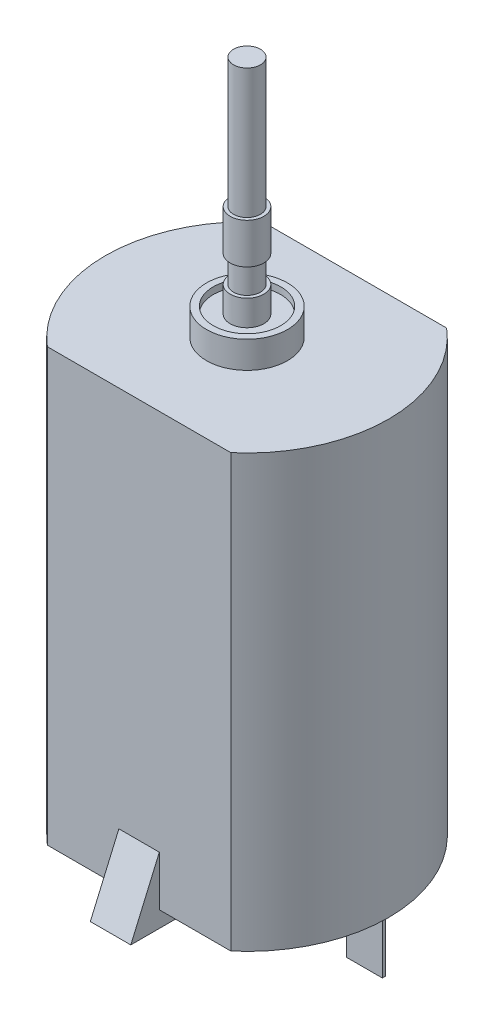
from build123d import *

# Parameters (mm, degrees)
SKETCH_1_W          = 21
SKETCH_1_H          = 16
EXTRUDE_1_DEPTH     = 32
SKETCH_2_R          = 3
EXTRUDE_2_DEPTH     = 2
CUT_EXTRUDE_1_DEPTH = 37.47259245
SKETCH_4_W          = 2.646859644
SKETCH_4_H          = 0.228740956
EXTRUDE_3_DEPTH     = 4
EXTRUDE_START       = 2
SKETCH_5_R          = 3
EXTRUDE_4_DEPTH     = 2
SKETCH_6_R          = 2.5
CUT_EXTRUDE_2_DEPTH = 0.5
SKETCH_7_R          = 1
EXTRUDE_5_DEPTH     = 16.5
SKETCH_8_R          = 1.25
SKETCH_8_R_2        = 1
EXTRUDE_6_DEPTH     = 1.9
SKETCH_9_R          = 1.25
SKETCH_9_R_2        = 1
EXTRUDE_7_DEPTH     = 3
EXTRUDE_8_DEPTH     = 1.5
EXTRUDE_8_2_DEPTH   = 1.5


with BuildPart() as part:
    # 草图1 → 凸台-拉伸1 (new body)
    with BuildSketch(Plane(origin=(0, 0, 0), x_dir=(1, 0, 0), z_dir=(0, 1, 0))):
        Rectangle(SKETCH_1_W, SKETCH_1_H)
    extrude(amount=EXTRUDE_1_DEPTH)

    # 草图2 → 凸台-拉伸2 (add)
    with BuildSketch(Plane.XZ):
        with Locations(Location((0, 0, 0), (0, 0, 270))):
            Circle(SKETCH_2_R)
    extrude(amount=EXTRUDE_2_DEPTH)

    # 草图3 → 切除-拉伸1 (cut, through all)
    with BuildSketch(Plane(origin=(0, 32, 0), x_dir=(1, 0, 0), z_dir=(0, 1, 0))):
        with BuildLine():
            ThreePointArc((-6.800735254, -8), (-9.530417624, -4.406942241), (-10.5, 0))
            Line((-10.5, 0), (-10.5, -8))
            Line((-10.5, -8), (-6.800735254, -8))
        make_face()
        with BuildLine():
            Line((10.5, -8), (10.5, 0))
            ThreePointArc((10.5, 0), (9.530417624, -4.406942241), (6.800735254, -8))
            Line((6.800735254, -8), (10.5, -8))
        make_face()
        with BuildLine():
            Line((10.5, 8), (6.800735254, 8))
            ThreePointArc((6.800735254, 8), (9.530417624, 4.406942241), (10.5, 0))
            Line((10.5, 0), (10.5, 8))
        make_face()
        with BuildLine():
            ThreePointArc((-10.5, 0), (-9.530417624, 4.406942241), (-6.800735254, 8))
            Line((-6.800735254, 8), (-10.5, 8))
            Line((-10.5, 8), (-10.5, 0))
        make_face()
    extrude(amount=-CUT_EXTRUDE_1_DEPTH, mode=Mode.SUBTRACT)

    # 草图4 → 凸台-拉伸3 (add)
    with BuildSketch(Plane.XZ):
        with Locations((-8.822865481, 0)):
            Rectangle(SKETCH_4_W, SKETCH_4_H)
        with Locations((8.822865481, 0)):
            Rectangle(SKETCH_4_W, SKETCH_4_H)
    extrude(amount=EXTRUDE_3_DEPTH)

    # 草图5 → 凸台-拉伸4 (add)
    with BuildSketch(Plane(origin=(0, 32, 0), x_dir=(1, 0, 0), z_dir=(0, 1, 0)).offset(EXTRUDE_START)):
        with Locations(Location((0, 0, 0), (0, 0, 90))):
            Circle(SKETCH_5_R)
    extrude(amount=-EXTRUDE_4_DEPTH)

    # 草图6 → 切除-拉伸2 (cut)
    with BuildSketch(Plane(origin=(0, 34, 0), x_dir=(1, 0, 0), z_dir=(0, 1, 0))):
        with Locations(Location((0, 0, 0), (0, 0, 270))):
            Circle(SKETCH_6_R)
    extrude(amount=-CUT_EXTRUDE_2_DEPTH, mode=Mode.SUBTRACT)

    # 草图7 → 凸台-拉伸5 (add)
    with BuildSketch(Plane(origin=(0, 33.5, 0), x_dir=(1, 0, 0), z_dir=(0, 1, 0))):
        with Locations(Location((0, 0, 0), (0, 0, 270))):
            Circle(SKETCH_7_R)
    extrude(amount=EXTRUDE_5_DEPTH)

    # 草图8 → 凸台-拉伸6 (add)
    # profile 1 of 2: a face of its own
    with BuildSketch(Plane(origin=(0, 33.5, 0), x_dir=(1, 0, 0), z_dir=(0, 1, 0))):
        Circle(SKETCH_8_R)
        Circle(SKETCH_8_R_2, mode=Mode.SUBTRACT)
    # profile 2 of 2: a face of its own
    with BuildSketch(Plane(origin=(0, 33.5, 0), x_dir=(1, 0, 0), z_dir=(0, 1, 0))):
        Circle(SKETCH_8_R_2)
    extrude(amount=EXTRUDE_6_DEPTH)

    # 草图9 → 凸台-拉伸7 (add)
    with BuildSketch(Plane(origin=(0, 37.4, 0), x_dir=(1, 0, 0), z_dir=(0, 1, 0))):
        Circle(SKETCH_9_R)
        Circle(SKETCH_9_R_2, mode=Mode.SUBTRACT)
    extrude(amount=EXTRUDE_7_DEPTH)


with BuildPart() as body_2:
    # 草图11 → 凸台-拉伸8 (new, symmetric)
    with BuildSketch(Plane(origin=(0, 0, 0), x_dir=(0, 0, -1), z_dir=(1, 0, 0))):
        Polygon((8, 3.697239799), (10.114850758, -1.2), (6.552999181, -1.2), (6.552999181, 0), (8, 0), align=None)
    extrude(amount=EXTRUDE_8_DEPTH, both=True)


with BuildPart() as body_3:
    # 草图11 → Extrude 8 2 (new, symmetric)
    with BuildSketch(Plane(origin=(0, 0, 0), x_dir=(0, 0, -1), z_dir=(1, 0, 0))):
        Polygon((-8, 0), (-8, 3.697239799), (-10.114850758, -1.2), (-6.552999181, -1.2), (-6.552999181, 0), align=None)
    extrude(amount=EXTRUDE_8_2_DEPTH, both=True)


solid = Compound([part.part, body_2.part, body_3.part])
